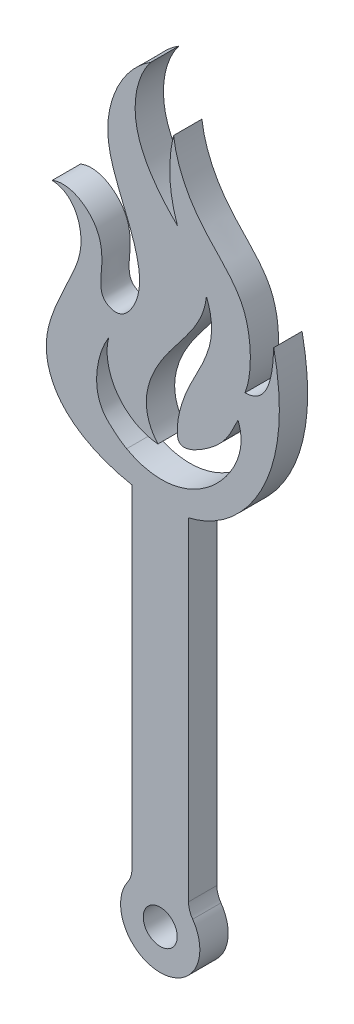
from build123d import *

# Parameters (mm, degrees)
SKETCH_1_R      = 1.5
EXTRUDE_1_DEPTH = 2.5
EXTRUDE_2_DEPTH = 2.5


with BuildPart() as part:
    # 草图1 → 凸台-拉伸1 (new body)
    with BuildSketch(Plane.XY):
        with BuildLine():
            Line((-2.5, 3.16227766), (-2.5, 33.16227766))
            Line((-2.5, 33.16227766), (2.5, 33.16227766))
            Line((2.5, 33.16227766), (2.5, 3.16227766))
            ThreePointArc((2.5, 3.16227766), (2.593074822, 2.559254971), (2.863636364, 2.012358511))
            ThreePointArc((2.863636364, 2.012358511), (0, -3.5), (-2.863636364, 2.012358511))
            ThreePointArc((-2.863636364, 2.012358511), (-2.593074822, 2.559254971), (-2.5, 3.16227766))
        make_face()
        Circle(SKETCH_1_R, mode=Mode.SUBTRACT)
    extrude(amount=EXTRUDE_1_DEPTH)

    # 草图3 → 凸台-拉伸2 (add)
    with BuildSketch(Plane.XY):
        with BuildLine():
            add(Edge.make_bspline(
                [(1.69954817, 32.369864996), (-1.385100221, 31.947001873), (-8.130831258, 33.185581337), (-10.859502881, 40.267632339), (-8.337089088, 44.467605106), (-6.470249986, 49.192724162), (-7.652817965, 52.207834836), (-9.53875205, 52.298610494)],
                knots=[0, 0, 0, 0, 0.389446078, 0.476704243, 0.741561353, 0.833903947, 1, 1, 1, 1], degree=3))
            add(Edge.make_bspline(
                [(-9.53875205, 52.298610494), (-8.040527703, 52.926182403), (-5.269716306, 51.236121551), (-5.04798894, 48.004762941), (-5.462707765, 45.555973743), (-3.35046463, 44.629179102), (-1.681816702, 47.050669753), (-1.843533217, 50.093838619), (-3.26797623, 53.732460439), (-5.693852916, 59.188539055), (-3.322064151, 64.113948902), (-0.848437868, 65.666402499)],
                knots=[0, 0, 0, 0, 0.13507355, 0.221026783, 0.289623495, 0.317982017, 0.397027048, 0.482985462, 0.593400841, 0.740558491, 1, 1, 1, 1], degree=3))
            add(Edge.make_bspline(
                [(-0.848437868, 65.666402499), (-2.023179677, 64.141172848), (-2.966973993, 59.570046349), (-0.077079319, 55.920484579), (1.518038951, 54.368227425)],
                knots=[0, 0, 0, 0, 0.453669463, 1, 1, 1, 1], degree=3))
            add(Edge.make_bspline(
                [(1.518038951, 54.368227425), (0.358733968, 57.663818474), (1.178197949, 61.089527261)],
                knots=[0, 0, 0, 1, 1, 1], degree=2))
            add(Edge.make_bspline(
                [(1.178197949, 61.089527261), (1.4547281, 58.963573565), (3.221226307, 55.369510946), (7.325552017, 52.105323964), (8.09982119, 47.949849275), (7.909886115, 45.703967583), (7.48535231, 44.569359802)],
                knots=[0, 0, 0, 0, 0.342132631, 0.634924534, 0.806626117, 1, 1, 1, 1], degree=3))
            add(Edge.make_bspline(
                [(7.48535231, 44.569359802), (9.814670975, 44.570692492), (9.954388393, 47.717517246), (10.021519576, 49.29262338)],
                knots=[0, 0, 0, 0, 1, 1, 1, 1], degree=3))
            add(Edge.make_bspline(
                [(10.021519576, 49.29262338), (10.562922915, 46.691122044), (10.847359943, 41.996548165), (8.019125109, 35.382898269), (4.246580661, 32.719028329), (1.69954817, 32.369864996)],
                knots=[0, 0, 0, 0, 0.383344552, 0.656086203, 1, 1, 1, 1], degree=3))
        make_face()
        with BuildLine():
            add(Edge.make_bspline(
                [(-2.962222667, 35.070219426), (-1.836090695, 34.433005965), (1.647740936, 33.680903865), (6.288041871, 36.851211843), (7.481510922, 40.662283382), (6.871438175, 42.171559804)],
                knots=[0, 0, 0, 0, 0.254823984, 0.682331243, 1, 1, 1, 1], degree=3))
            add(Edge.make_bspline(
                [(6.871438175, 42.171559804), (6.183533455, 40.757922072), (5.542404301, 39.305836406), (1.504542336, 36.992420969), (1.486547043, 39.123353663), (1.706861403, 40.376400276), (2.317072264, 42.215534808), (3.50838251, 44.400641403), (4.778523529, 47.154878789), (4.46675167, 49.307706612), (4.077808767, 50.238963584)],
                knots=[0, 0, 0, 0, 0.205207901, 0.355343408, 0.404867241, 0.471006588, 0.557598083, 0.689135551, 0.848468013, 1, 1, 1, 1], degree=3))
            add(Edge.make_bspline(
                [(4.077808767, 50.238963584), (3.917125099, 48.487792695), (2.139207405, 46.058370573), (-0.976600455, 42.195303759), (-1.799939404, 38.664744027), (-0.206092881, 36.807870035)],
                knots=[0, 0, 0, 0, 0.339221599, 0.587956722, 1, 1, 1, 1], degree=3))
            add(Edge.make_bspline(
                [(-0.206092881, 36.807870035), (-1.575317235, 36.920801398), (-4.221159951, 38.39367897), (-4.913772652, 41.429018589), (-4.544793312, 42.786314057)],
                knots=[0, 0, 0, 0, 0.493076316, 1, 1, 1, 1], degree=3))
            add(Edge.make_bspline(
                [(-4.544793312, 42.786314057), (-5.52706483, 41.225882807), (-6.284796896, 37.946935821), (-4.105866091, 35.85503913), (-3.490018592, 35.368868854), (-2.962222667, 35.070219426)],
                knots=[0, 0, 0, 0, 0.715192833, 0.8118662, 1, 1, 1, 1], degree=3))
        make_face(mode=Mode.SUBTRACT)
    extrude(amount=EXTRUDE_2_DEPTH)


solid = part.part
